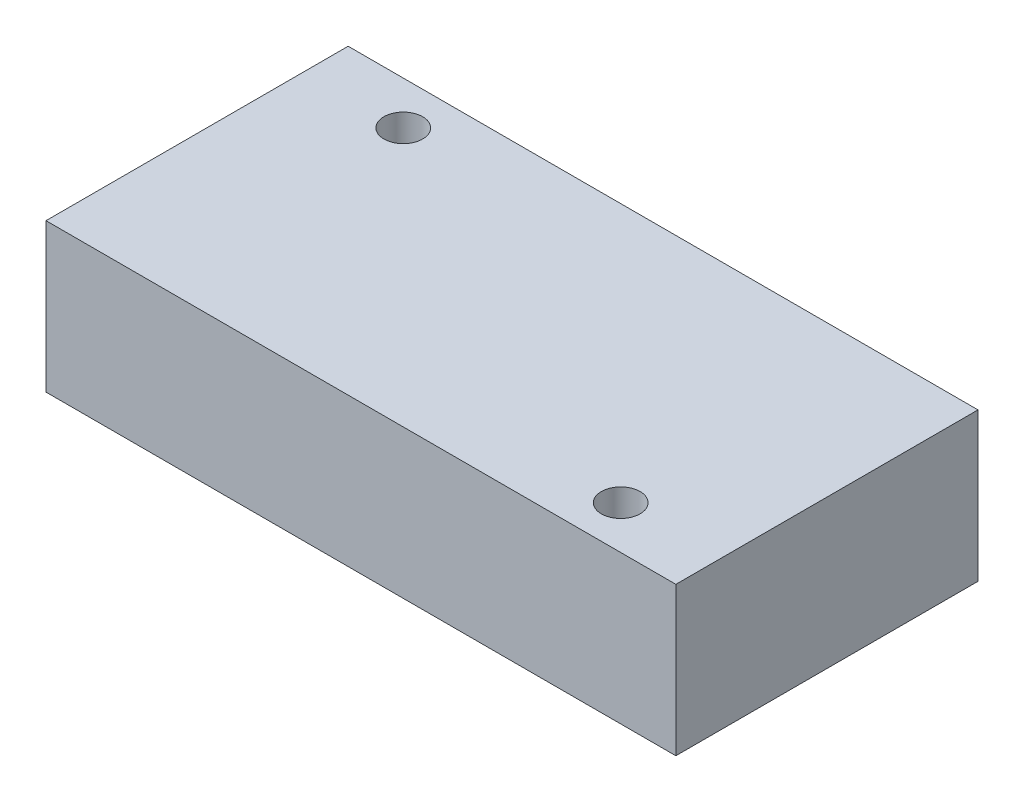
from build123d import *

# Parameters (mm, degrees)
SKETCH1_W           = 48.78
SKETCH1_H           = 23.4
BOSS_EXTRUDE1_DEPTH = 11.5
CUT_EXTRUDE1_REACH  = 31.394
SKETCH2_R           = 1.5


with BuildPart() as part:
    # Sketch1 → Boss-Extrude1 (new body)
    with BuildSketch(Plane(origin=(0, 0, 0), x_dir=(1, 0, 0), z_dir=(0, 1, 0))):
        Rectangle(SKETCH1_W, SKETCH1_H)
    extrude(amount=BOSS_EXTRUDE1_DEPTH)

    # Sketch2 → Cut-Extrude1 (cut, up to next)
    with BuildSketch(Plane(origin=(0, 11.5, 0), x_dir=(1, 0, 0), z_dir=(0, 1, 0)), mode=Mode.PRIVATE) as cut_extrude1_sk1:
        with Locations(Location((-16.78, 8.36, 0), (0, 0, 270))):
            Circle(SKETCH2_R)
    cut_extrude1_tool1 = extrude(cut_extrude1_sk1.sketch, amount=-CUT_EXTRUDE1_REACH, mode=Mode.PRIVATE) & part.part
    # Sketch2 → Cut-Extrude1 (cut, up to next)
    with BuildSketch(Plane(origin=(0, 11.5, 0), x_dir=(1, 0, 0), z_dir=(0, 1, 0)), mode=Mode.PRIVATE) as cut_extrude1_sk2:
        with Locations(Location((16.78, -8.36, 0), (0, 0, 270))):
            Circle(SKETCH2_R)
    cut_extrude1_tool2 = extrude(cut_extrude1_sk2.sketch, amount=-CUT_EXTRUDE1_REACH, mode=Mode.PRIVATE) & part.part
    add(cut_extrude1_tool1.solids().sort_by_distance((-16.78, 11.5, -8.36))[0], mode=Mode.SUBTRACT)
    add(cut_extrude1_tool2.solids().sort_by_distance((16.78, 11.5, 8.36))[0], mode=Mode.SUBTRACT)


solid = part.part
